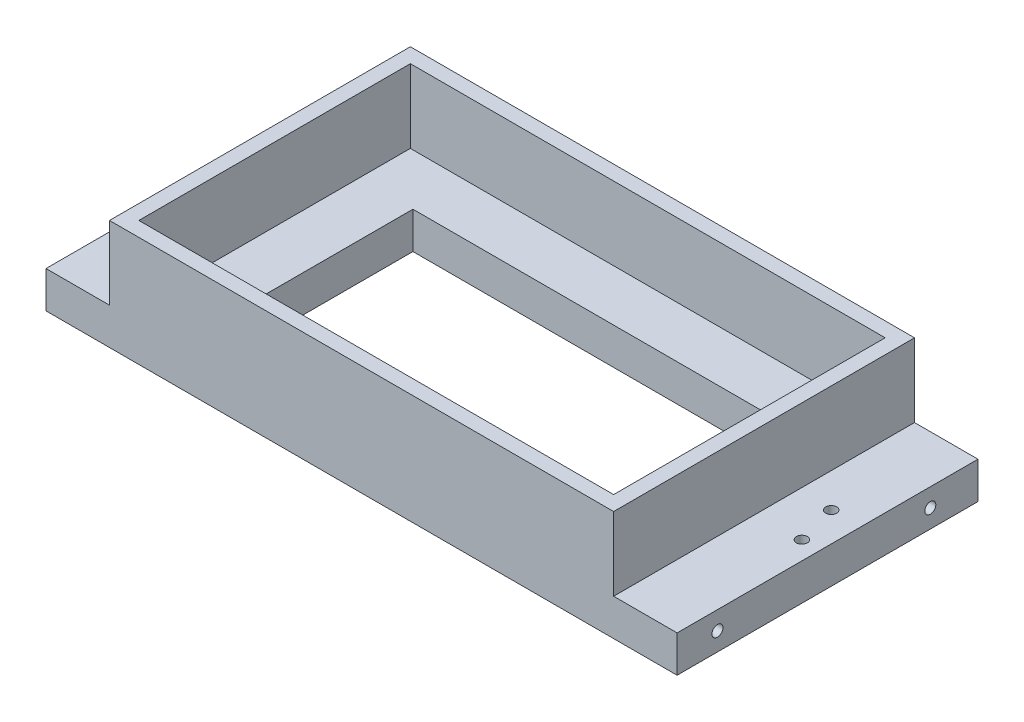
from build123d import *

# Parameters (mm, degrees)
SKETCH_1_W          = 86
SKETCH_1_H          = 174
SKETCH_1_W_2        = 50
SKETCH_1_H_2        = 25
SKETCH_1_H_3        = 55
SKETCH_1_W_3        = 76
SKETCH_1_H_4        = 43
EXTRUDE_1_DEPTH     = 5
SKETCH_4_W          = 68.7
SKETCH_4_H          = 115
SKETCH_4_W_2        = 64.7
SKETCH_4_H_2        = 37
SKETCH_4_H_3        = 70
EXTRUDE_2_DEPTH     = 10
SKETCH_5_R          = 0.75
CUT_EXTRUDE_1_DEPTH = 122.783619588
SKETCH_7_W          = 15
SKETCH_7_H          = 8
SKETCH_7_W_2        = 26
SKETCH_7_W_3        = 5
SKETCH_7_H_2        = 10
SKETCH_7_H_3        = 12.119700025
SKETCH_7_W_4        = 6
SKETCH_7_H_4        = 5
SKETCH_7_W_5        = 7
SKETCH_7_H_5        = 21
CUT_EXTRUDE_2_DEPTH = 2
SKETCH_8_R          = 0.75
CUT_EXTRUDE_3_DEPTH = 2
CUT_EXTRUDE_START   = -84
SKETCH_8_3_R        = 0.75
CUT_EXTRUDE_4_DEPTH = 2
SKETCH_9_R          = 0.75
SKETCH_9_W          = 50
SKETCH_9_H          = 55
SKETCH_9_W_2        = 86
SKETCH_9_H_2        = 56
SKETCH_9_W_3        = 76
SKETCH_9_H_3        = 43
CUT_EXTRUDE_5_DEPTH = 123.295748086


with BuildPart() as part:
    # 草图1 → 凸台-拉伸1 (new body)
    with BuildSketch(Plane(origin=(0, 0, 0), x_dir=(1, 0, 0), z_dir=(0, 1, 0))):
        with Locations((0, -26.5)):
            Rectangle(SKETCH_1_W, SKETCH_1_H)
        with Locations((0, -38)):
            Rectangle(SKETCH_1_W_2, SKETCH_1_H_2, mode=Mode.SUBTRACT)
        with Locations((0, 23)):
            Rectangle(SKETCH_1_W_2, SKETCH_1_H_3, mode=Mode.SUBTRACT)
        with Locations((0, -87)):
            Rectangle(SKETCH_1_W_3, SKETCH_1_H_4, mode=Mode.SUBTRACT)
    extrude(amount=EXTRUDE_1_DEPTH)

    # 草图4 → 凸台-拉伸2 (add)
    with BuildSketch(Plane(origin=(0, 5, 0), x_dir=(1, 0, 0), z_dir=(0, 1, 0))):
        Rectangle(SKETCH_4_W, SKETCH_4_H)
        with Locations((0, -37)):
            Rectangle(SKETCH_4_W_2, SKETCH_4_H_2, mode=Mode.SUBTRACT)
        with Locations((0, 20.5)):
            Rectangle(SKETCH_4_W_2, SKETCH_4_H_3, mode=Mode.SUBTRACT)
    extrude(amount=EXTRUDE_2_DEPTH)

    # 草图5 → 切除-拉伸1 (cut, through all)
    with BuildSketch(Plane(origin=(0, 5, 0), x_dir=(1, 0, 0), z_dir=(0, 1, 0))):
        with Locations(Location((-39, 20.5, 0), (0, 0, 270))):
            Circle(SKETCH_5_R)
        with Locations(Location((39, 20.5, 0), (0, 0, 270))):
            Circle(SKETCH_5_R)
        with Locations(Location((-39, -32.5, 0), (0, 0, 270))):
            Circle(SKETCH_5_R)
        with Locations(Location((39, -32.5, 0), (0, 0, 270))):
            Circle(SKETCH_5_R)
        with Locations(Location((-40.1427775, -60.35, 0), (0, 0, 270))):
            Circle(SKETCH_5_R)
        with Locations(Location((40.1427775, -60.35, 0), (0, 0, 270))):
            Circle(SKETCH_5_R)
        with Locations(Location((-40.1427775, -110.530299975, 0), (0, 0, 270))):
            Circle(SKETCH_5_R)
        with Locations(Location((40.1427775, -110.530299975, 0), (0, 0, 270))):
            Circle(SKETCH_5_R)
        with Locations(Location((-40.5, 57.5, 0), (0, 0, 270))):
            Circle(SKETCH_5_R)
        with Locations(Location((-40.5, -38, 0), (0, 0, 270))):
            Circle(SKETCH_5_R)
        with Locations(Location((-40.5, -85.5, 0), (0, 0, 270))):
            Circle(SKETCH_5_R)
        with Locations(Location((40.5, 57.5, 0), (0, 0, 270))):
            Circle(SKETCH_5_R)
        with Locations(Location((40.5, -38, 0), (0, 0, 270))):
            Circle(SKETCH_5_R)
        with Locations(Location((40.5, -85.5, 0), (0, 0, 270))):
            Circle(SKETCH_5_R)
        with Locations(Location((-40.5, -4.5, 0), (0, 0, 270))):
            Circle(SKETCH_5_R)
        with Locations(Location((40.5, -4.5, 0), (0, 0, 270))):
            Circle(SKETCH_5_R)
    extrude(amount=-CUT_EXTRUDE_1_DEPTH, mode=Mode.SUBTRACT)

    # 草图7 → 切除-拉伸2 (cut)
    with BuildSketch(Plane(origin=(0, 5, 0), x_dir=(1, 0, 0), z_dir=(0, 1, 0))):
        with Locations((-24.5, -61.5)):
            Rectangle(SKETCH_7_W, SKETCH_7_H)
        with Locations((0, -61.5)):
            Rectangle(SKETCH_7_W_2, SKETCH_7_H)
        with Locations((-40.5, -78.5)):
            Rectangle(SKETCH_7_W_3, SKETCH_7_H_2)
        with Locations((-40.5, -101.440149988)):
            Rectangle(SKETCH_7_W_3, SKETCH_7_H_3)
        with Locations((-32, -111)):
            Rectangle(SKETCH_7_W_4, SKETCH_7_H_4)
        with Locations((-3, -111)):
            Rectangle(SKETCH_7_W_4, SKETCH_7_H_4)
        with Locations((17.5, -111)):
            Rectangle(SKETCH_7_W_5, SKETCH_7_H_4)
        with Locations((30.5, -111)):
            Rectangle(SKETCH_7_W_5, SKETCH_7_H_4)
        with Locations((40.5, -92)):
            Rectangle(SKETCH_7_W_3, SKETCH_7_H_5)
    extrude(amount=-CUT_EXTRUDE_2_DEPTH, mode=Mode.SUBTRACT)

    # 草图8 → 切除-拉伸3 (cut)
    with BuildSketch(Plane.ZY.offset(43)):
        with Locations((8, 2.5)):
            Circle(SKETCH_8_R)
        with Locations((23, 2.5)):
            Circle(SKETCH_8_R)
        with Locations((52, 2.5)):
            Circle(SKETCH_8_R)
        with Locations((63, 2.5)):
            Circle(SKETCH_8_R)
    extrude(amount=-CUT_EXTRUDE_3_DEPTH, mode=Mode.SUBTRACT)

    # 草图8<3> → 切除-拉伸4 (cut)
    with BuildSketch(Plane.ZY.offset(43).offset(CUT_EXTRUDE_START)):
        with Locations((8, 2.5)):
            Circle(SKETCH_8_3_R)
        with Locations((23, 2.5)):
            Circle(SKETCH_8_3_R)
        with Locations((52, 2.5)):
            Circle(SKETCH_8_3_R)
        with Locations((63, 2.5)):
            Circle(SKETCH_8_3_R)
    extrude(amount=-CUT_EXTRUDE_4_DEPTH, mode=Mode.SUBTRACT)

    # 草图9 → 切除-拉伸5 (cut, through all)
    # profile 1 of 2: a face of its own
    with BuildSketch(Plane(origin=(0, 0, 0), x_dir=(1, 0, 0), z_dir=(0, 1, 0))):
        Polygon((-43, 60.5), (-43, -16.5), (0, -16.5), (43, -16.5), (43, 60.5), align=None)
        with Locations((-40.5, -4.5)):
            Circle(SKETCH_9_R, mode=Mode.SUBTRACT)
        with Locations((-39, 20.5)):
            Circle(SKETCH_9_R, mode=Mode.SUBTRACT)
        with Locations((-40.5, 57.5)):
            Circle(SKETCH_9_R, mode=Mode.SUBTRACT)
        with Locations((0, 23)):
            Rectangle(SKETCH_9_W, SKETCH_9_H, mode=Mode.SUBTRACT)
        with Locations((40.5, -4.5)):
            Circle(SKETCH_9_R, mode=Mode.SUBTRACT)
        with Locations((39, 20.5)):
            Circle(SKETCH_9_R, mode=Mode.SUBTRACT)
        with Locations((40.5, 57.5)):
            Circle(SKETCH_9_R, mode=Mode.SUBTRACT)
    # profile 2 of 2: a face of its own
    with BuildSketch(Plane(origin=(0, 0, 0), x_dir=(1, 0, 0), z_dir=(0, 1, 0))):
        with Locations((0, -85.5)):
            Rectangle(SKETCH_9_W_2, SKETCH_9_H_2)
        with Locations((-40.1427775, -110.530299975)):
            Circle(SKETCH_9_R, mode=Mode.SUBTRACT)
        with Locations((-40.5, -85.5)):
            Circle(SKETCH_9_R, mode=Mode.SUBTRACT)
        with Locations((0, -87)):
            Rectangle(SKETCH_9_W_3, SKETCH_9_H_3, mode=Mode.SUBTRACT)
        with Locations((-40.1427775, -60.35)):
            Circle(SKETCH_9_R, mode=Mode.SUBTRACT)
        with Locations((40.1427775, -110.530299975)):
            Circle(SKETCH_9_R, mode=Mode.SUBTRACT)
        with Locations((40.5, -85.5)):
            Circle(SKETCH_9_R, mode=Mode.SUBTRACT)
        with Locations((40.1427775, -60.35)):
            Circle(SKETCH_9_R, mode=Mode.SUBTRACT)
    extrude(amount=CUT_EXTRUDE_5_DEPTH, mode=Mode.SUBTRACT)


solid = part.part
